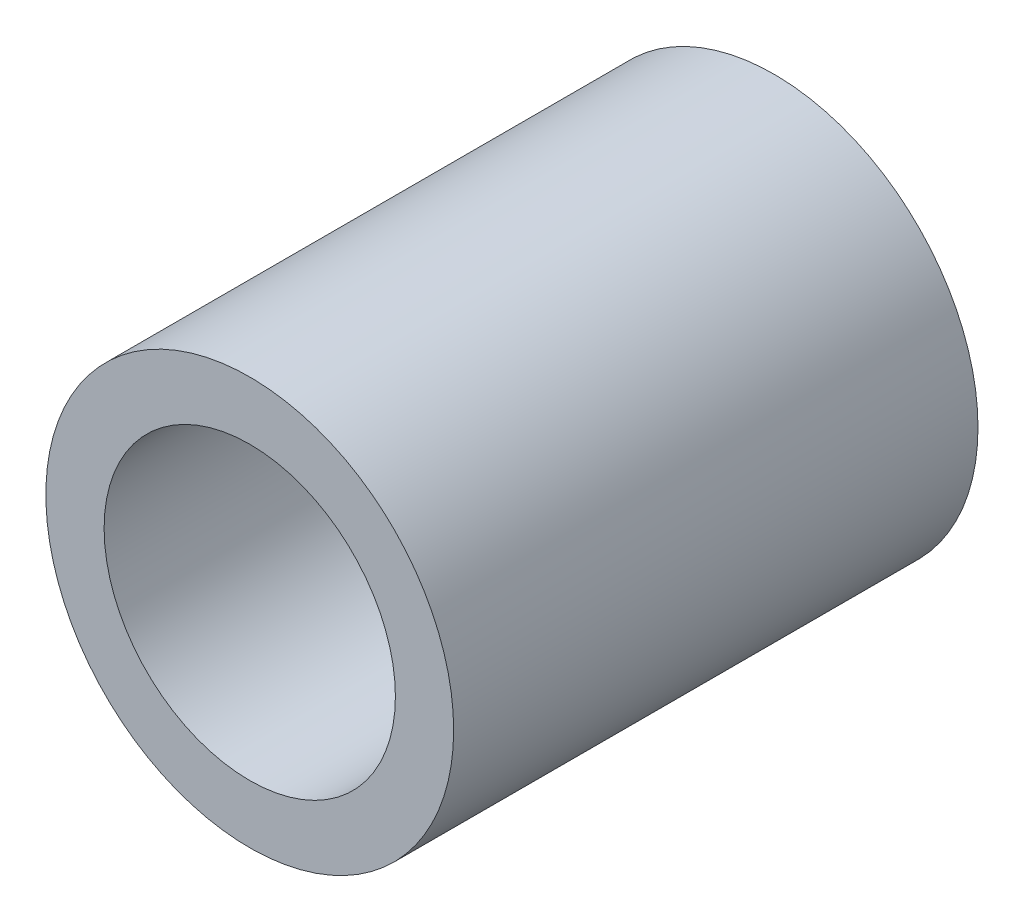
from build123d import *

# Parameters (mm, degrees)
SKETCH1_R           = 3.5
SKETCH1_R_2         = 2.5
BOSS_EXTRUDE1_DEPTH = 9


with BuildPart() as part:
    # Sketch1 → Boss-Extrude1 (new body)
    with BuildSketch(Plane.XY):
        Circle(SKETCH1_R)
        Circle(SKETCH1_R_2, mode=Mode.SUBTRACT)
    extrude(amount=BOSS_EXTRUDE1_DEPTH)


solid = part.part
